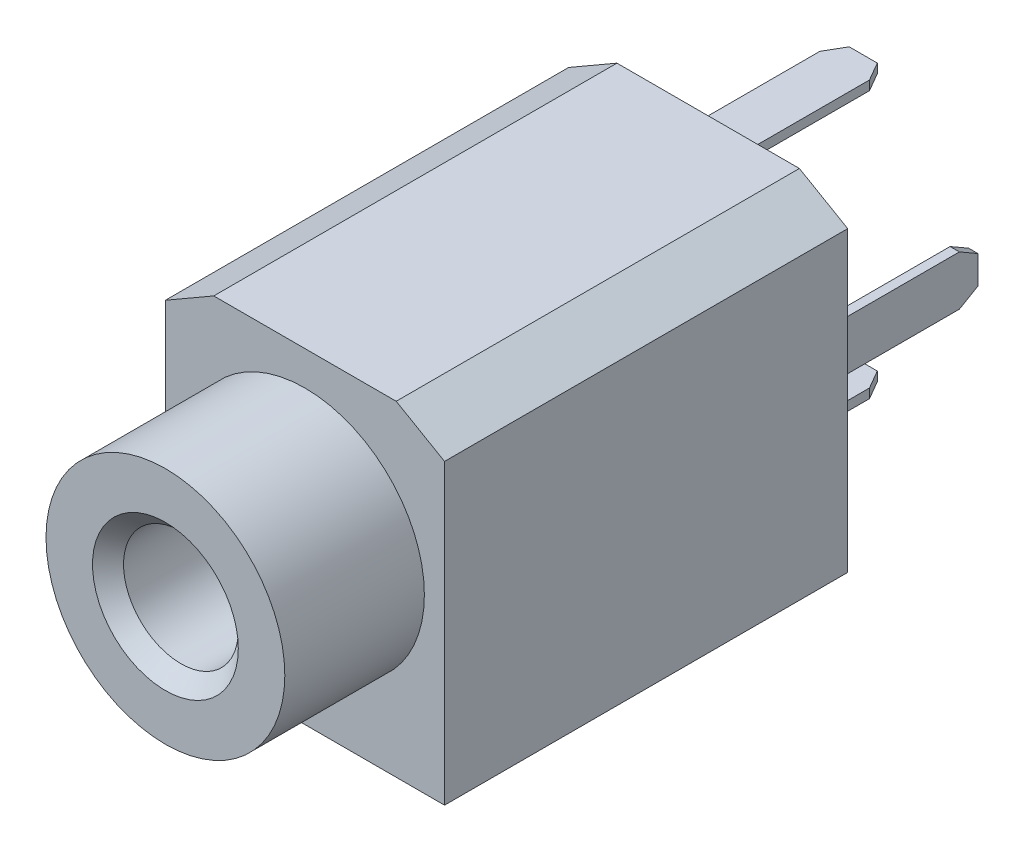
from build123d import *
from OCP.BRepFilletAPI import BRepFilletAPI_MakeChamfer

# Parameters (mm, degrees)
SKETCH1_R           = 3.85
BOSS_EXTRUDE1_DEPTH = 4.5
SKETCH2_W           = 9
SKETCH2_H           = 10.5
BOSS_EXTRUDE2_DEPTH = 13
CHAMFER1_SIZE       = 0.9
CHAMFER1_SIZE2      = 1.558845727
SKETCH3_W           = 1.6
SKETCH3_H           = 0.3
SKETCH3_W_2         = 0.3
SKETCH3_H_2         = 1.6
BOSS_EXTRUDE3_DEPTH = 5
CHAMFER2_SIZE       = 0.6
CHAMFER2_SIZE2      = 0.346410162
SKETCH4_R           = 1.85
CUT_EXTRUDE1_DEPTH  = 17.5
CHAMFER3_SIZE       = 0.5


with BuildPart() as part:
    # Sketch1 → Boss-Extrude1 (new body)
    with BuildSketch(Plane.XY):
        Circle(SKETCH1_R)
    extrude(amount=BOSS_EXTRUDE1_DEPTH)

    # Sketch2 → Boss-Extrude2 (add)
    with BuildSketch(Plane(origin=(0, 0, 0), x_dir=(-1, 0, 0), z_dir=(0, 0, -1))):
        with Locations((0, -0.3)):
            Rectangle(SKETCH2_W, SKETCH2_H)
    extrude(amount=BOSS_EXTRUDE2_DEPTH)

    # Chamfer1: one chamfer whose edges measure the first distance from different faces: ONE call of the kernel's chamfer builder (chamfer() names one face for all edges)
    chamfer1_edges_1 = [part.edges().sort_by_distance(p)[0] for p in [
        (-4.5, 4.95, -6.5),
    ]]
    chamfer1_side_1 = [part.faces().sort_by_distance(p)[0] for p in [
        (-4.5, -0.3, -6.5),
    ]]
    chamfer1_edges_2 = [part.edges().sort_by_distance(p)[0] for p in [
        (4.5, 4.95, -6.5),
    ]]
    chamfer1_side_2 = [part.faces().sort_by_distance(p)[0] for p in [
        (4.5, -0.3, -6.5),
    ]]
    chamfer1 = BRepFilletAPI_MakeChamfer(part.part.solid().wrapped)
    for e in chamfer1_edges_1:
        chamfer1.Add(CHAMFER1_SIZE, CHAMFER1_SIZE2, e.wrapped, chamfer1_side_1[0].wrapped)  # the first distance lies on this face
    for e in chamfer1_edges_2:
        chamfer1.Add(CHAMFER1_SIZE, CHAMFER1_SIZE2, e.wrapped, chamfer1_side_2[0].wrapped)  # the first distance lies on this face
    add(Compound.cast(chamfer1.Shape()), mode=Mode.REPLACE)

    # Sketch3 → Boss-Extrude3 (add)
    with BuildSketch(Plane(origin=(0, 0, -13), x_dir=(-1, 0, 0), z_dir=(0, 0, -1))):
        with Locations((0, 4)):
            Rectangle(SKETCH3_W, SKETCH3_H)
        with Locations((3.55, 0)):
            Rectangle(SKETCH3_W_2, SKETCH3_H_2)
        with Locations((-3.55, 0)):
            Rectangle(SKETCH3_W_2, SKETCH3_H_2)
        with Locations((0, -4.6)):
            Rectangle(SKETCH3_W, SKETCH3_H)
    extrude(amount=BOSS_EXTRUDE3_DEPTH)

    # Chamfer2: one chamfer whose edges measure the first distance from different faces: ONE call of the kernel's chamfer builder (chamfer() names one face for all edges)
    chamfer2_edges_1 = [part.edges().sort_by_distance(p)[0] for p in [
        (0.8, 4, -18),
    ]]
    chamfer2_side_1 = [part.faces().sort_by_distance(p)[0] for p in [
        (0.8, 4, -15.5),
    ]]
    chamfer2_edges_2 = [part.edges().sort_by_distance(p)[0] for p in [
        (-0.8, 4, -18),
    ]]
    chamfer2_side_2 = [part.faces().sort_by_distance(p)[0] for p in [
        (-0.8, 4, -15.5),
    ]]
    chamfer2_edges_3 = [part.edges().sort_by_distance(p)[0] for p in [
        (-3.55, -0.8, -18),
    ]]
    chamfer2_side_3 = [part.faces().sort_by_distance(p)[0] for p in [
        (-3.55, -0.8, -15.5),
    ]]
    chamfer2_edges_4 = [part.edges().sort_by_distance(p)[0] for p in [
        (-3.55, 0.8, -18),
    ]]
    chamfer2_side_4 = [part.faces().sort_by_distance(p)[0] for p in [
        (-3.55, 0.8, -15.5),
    ]]
    chamfer2_edges_5 = [part.edges().sort_by_distance(p)[0] for p in [
        (3.55, -0.8, -18),
    ]]
    chamfer2_side_5 = [part.faces().sort_by_distance(p)[0] for p in [
        (3.55, -0.8, -15.5),
    ]]
    chamfer2_edges_6 = [part.edges().sort_by_distance(p)[0] for p in [
        (3.55, 0.8, -18),
    ]]
    chamfer2_side_6 = [part.faces().sort_by_distance(p)[0] for p in [
        (3.55, 0.8, -15.5),
    ]]
    chamfer2_edges_7 = [part.edges().sort_by_distance(p)[0] for p in [
        (0.8, -4.6, -18),
    ]]
    chamfer2_side_7 = [part.faces().sort_by_distance(p)[0] for p in [
        (0.8, -4.6, -15.5),
    ]]
    chamfer2_edges_8 = [part.edges().sort_by_distance(p)[0] for p in [
        (-0.8, -4.6, -18),
    ]]
    chamfer2_side_8 = [part.faces().sort_by_distance(p)[0] for p in [
        (-0.8, -4.6, -15.5),
    ]]
    chamfer2 = BRepFilletAPI_MakeChamfer(part.part.solid().wrapped)
    for e in chamfer2_edges_1:
        chamfer2.Add(CHAMFER2_SIZE, CHAMFER2_SIZE2, e.wrapped, chamfer2_side_1[0].wrapped)  # the first distance lies on this face
    for e in chamfer2_edges_2:
        chamfer2.Add(CHAMFER2_SIZE, CHAMFER2_SIZE2, e.wrapped, chamfer2_side_2[0].wrapped)  # the first distance lies on this face
    for e in chamfer2_edges_3:
        chamfer2.Add(CHAMFER2_SIZE, CHAMFER2_SIZE2, e.wrapped, chamfer2_side_3[0].wrapped)  # the first distance lies on this face
    for e in chamfer2_edges_4:
        chamfer2.Add(CHAMFER2_SIZE, CHAMFER2_SIZE2, e.wrapped, chamfer2_side_4[0].wrapped)  # the first distance lies on this face
    for e in chamfer2_edges_5:
        chamfer2.Add(CHAMFER2_SIZE, CHAMFER2_SIZE2, e.wrapped, chamfer2_side_5[0].wrapped)  # the first distance lies on this face
    for e in chamfer2_edges_6:
        chamfer2.Add(CHAMFER2_SIZE, CHAMFER2_SIZE2, e.wrapped, chamfer2_side_6[0].wrapped)  # the first distance lies on this face
    for e in chamfer2_edges_7:
        chamfer2.Add(CHAMFER2_SIZE, CHAMFER2_SIZE2, e.wrapped, chamfer2_side_7[0].wrapped)  # the first distance lies on this face
    for e in chamfer2_edges_8:
        chamfer2.Add(CHAMFER2_SIZE, CHAMFER2_SIZE2, e.wrapped, chamfer2_side_8[0].wrapped)  # the first distance lies on this face
    add(Compound.cast(chamfer2.Shape()), mode=Mode.REPLACE)

    # Sketch4 → Cut-Extrude1 (cut)
    with BuildSketch(Plane.XY.offset(4.5)):
        Circle(SKETCH4_R)
    extrude(amount=-CUT_EXTRUDE1_DEPTH, mode=Mode.SUBTRACT)

    # Chamfer3
    chamfer3_edges = [part.edges().sort_by_distance(p)[0] for p in [
        (-1.85, 0, 4.5),
    ]]
    chamfer(chamfer3_edges, length=CHAMFER3_SIZE)


solid = part.part
